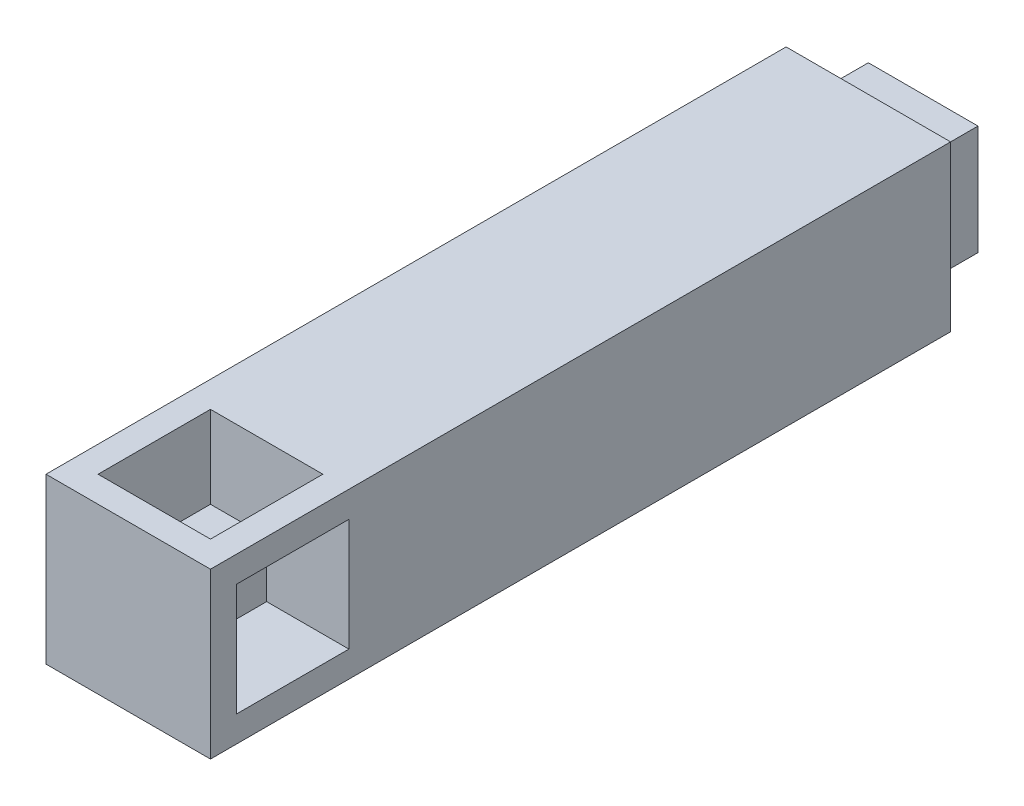
from build123d import *

# Parameters (mm, degrees)
SKETCH1_W           = 30
SKETCH1_H           = 30
BOSS_EXTRUDE1_DEPTH = 135
SKETCH2_W           = 20
SKETCH2_H           = 20
BOSS_EXTRUDE2_DEPTH = 10
SKETCH3_W           = 20.5
SKETCH3_H           = 20.5
CUT_EXTRUDE1_DEPTH  = 15
SKETCH4_W           = 20.5
SKETCH4_H           = 20.5
CUT_EXTRUDE2_DEPTH  = 15


with BuildPart() as part:
    # Sketch1 → Boss-Extrude1 (new body)
    with BuildSketch(Plane.XY):
        Rectangle(SKETCH1_W, SKETCH1_H)
    extrude(amount=BOSS_EXTRUDE1_DEPTH)

    # Sketch2 → Boss-Extrude2 (add)
    with BuildSketch(Plane.XY):
        Rectangle(SKETCH2_W, SKETCH2_H)
    extrude(amount=-BOSS_EXTRUDE2_DEPTH)

    # Sketch3 → Cut-Extrude1 (cut)
    with BuildSketch(Plane(origin=(15, 0, 0), x_dir=(0, 0, -1), z_dir=(1, 0, 0))):
        with Locations((-120, 0)):
            Rectangle(SKETCH3_W, SKETCH3_H)
    extrude(amount=-CUT_EXTRUDE1_DEPTH, mode=Mode.SUBTRACT)

    # Sketch4 → Cut-Extrude2 (cut)
    with BuildSketch(Plane(origin=(0, 15, 0), x_dir=(1, 0, 0), z_dir=(0, 1, 0))):
        with Locations((0, -120)):
            Rectangle(SKETCH4_W, SKETCH4_H)
    extrude(amount=-CUT_EXTRUDE2_DEPTH, mode=Mode.SUBTRACT)


solid = part.part
